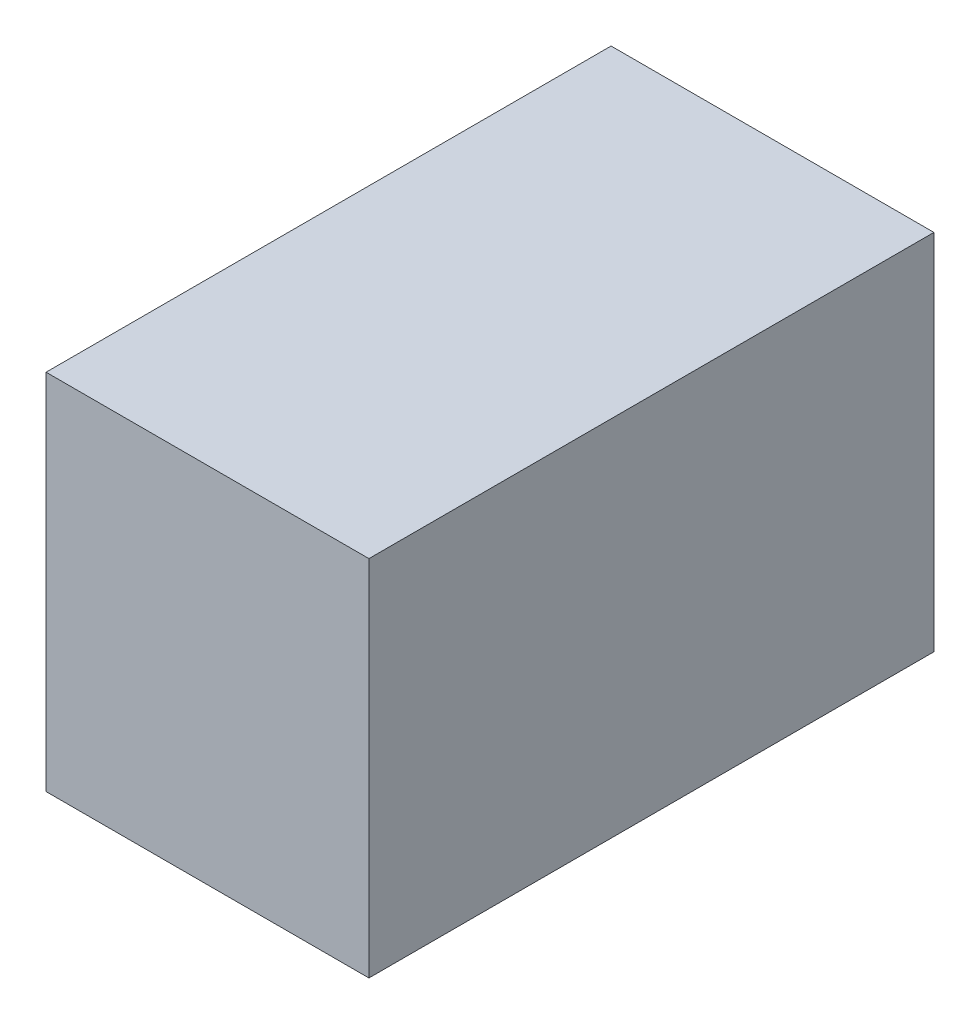
from build123d import *

# Parameters (mm, degrees)
SKETCH1_W           = 40
SKETCH1_H           = 70
BOSS_EXTRUDE1_DEPTH = 45
SKETCH2_W           = 0.474893162
SKETCH2_H           = 5.427350427
SKETCH2_W_2         = 0.474893163
BOSS_EXTRUDE2_DEPTH = 1.6


with BuildPart() as part:
    # Sketch1 → Boss-Extrude1 (new body)
    with BuildSketch(Plane(origin=(0, 0, 0), x_dir=(1, 0, 0), z_dir=(0, 1, 0))):
        Rectangle(SKETCH1_W, SKETCH1_H)
    extrude(amount=BOSS_EXTRUDE1_DEPTH)

    # Sketch2 → Boss-Extrude2 (add)
    # profile 1 of 16: a face of its own
    with BuildSketch(Plane.ZY.offset(20)):
        with BuildLine():
            Line((-18.131363664, 26.278418085), (-17.684031266, 26.546605519))
            add(Edge.make_bspline(
                [(-17.684031266, 26.546605519), (-17.642426312, 26.476960556), (-17.562712826, 26.343523494), (-17.429738747, 26.163216695), (-17.291954465, 26.009966768), (-17.148339639, 25.88466523), (-16.999770884, 25.786015127), (-16.845278327, 25.716161753), (-16.685382589, 25.672594743), (-16.576565026, 25.667302945), (-16.522239065, 25.664661074)],
                knots=[0, 0, 0, 0, 1.272034388, 2.437168799, 3.508375237, 4.49857839, 5.41946034, 6.295179144, 7.148887113, 8, 8, 8, 8], degree=3))
            add(Edge.make_bspline(
                [(-16.522239065, 25.664661074), (-16.475843455, 25.665953258), (-16.383864048, 25.668515014), (-16.248454466, 25.693130036), (-16.116946265, 25.730945993), (-15.992049872, 25.78510383), (-15.875488645, 25.850627493), (-15.773273761, 25.929769928), (-15.684908804, 26.01837693), (-15.612625976, 26.117229277), (-15.557169256, 26.223542108), (-15.514545534, 26.332665273), (-15.490891672, 26.446312989), (-15.487328485, 26.522831189), (-15.485530331, 26.56144593)],
                knots=[0, 0, 0, 0, 1.095163259, 2.171163733, 3.241058638, 4.321873601, 5.38011039, 6.391990106, 7.366004449, 8.327778327, 9.272591725, 10.192022065, 11.087607919, 12, 12, 12, 12], degree=3))
            add(Edge.make_bspline(
                [(-15.485530331, 26.56144593), (-15.487759348, 26.605504119), (-15.492290615, 26.69506798), (-15.5305894, 26.827207932), (-15.590837666, 26.95797646), (-15.646419283, 27.038865279), (-15.67527559, 27.080860326)],
                knots=[0, 0, 0, 0, 0.938893495, 1.908633276, 2.914225137, 4, 4, 4, 4], degree=3))
            add(Edge.make_bspline(
                [(-15.67527559, 27.080860326), (-15.698968066, 27.111169214), (-15.748707457, 27.174798934), (-15.834217029, 27.269512563), (-15.934556273, 27.367209459), (-16.04629141, 27.471620176), (-16.173492628, 27.57788863), (-16.312175893, 27.691082336), (-16.465881966, 27.806896625), (-16.573680014, 27.884567052), (-16.629302032, 27.924643713)],
                knots=[0, 0, 0, 0, 0.722233717, 1.516239348, 2.393582979, 3.351407094, 4.387010283, 5.505090956, 6.712668013, 8, 8, 8, 8], degree=3))
            add(Edge.make_bspline(
                [(-16.629302032, 27.924643713), (-16.684976408, 27.96429884), (-16.791421573, 28.040116422), (-16.940281573, 28.152638851), (-17.073396416, 28.255514702), (-17.190174453, 28.349712434), (-17.290564319, 28.435244825), (-17.375357096, 28.511290518), (-17.442392771, 28.57990614), (-17.479669661, 28.624418645), (-17.496406066, 28.644403662)],
                knots=[0, 0, 0, 0, 1.452282411, 2.77665338, 3.964542531, 5.026858415, 5.96415736, 6.766646006, 7.446254459, 8, 8, 8, 8], degree=3))
            add(Edge.make_bspline(
                [(-17.496406066, 28.644403662), (-17.51979908, 28.675550468), (-17.565804584, 28.736804842), (-17.626531758, 28.832545996), (-17.678146921, 28.930552599), (-17.718609019, 29.031088014), (-17.752681635, 29.132740823), (-17.775598983, 29.236837349), (-17.789949071, 29.342910498), (-17.791418622, 29.414292815), (-17.792154263, 29.450025991)],
                knots=[0, 0, 0, 0, 1.068054152, 2.10047183, 3.106115577, 4.101338837, 5.06977816, 6.043150881, 7.020423561, 8, 8, 8, 8], degree=3))
            add(Edge.make_bspline(
                [(-17.792154263, 29.450025991), (-17.790180911, 29.506011484), (-17.786276387, 29.616785818), (-17.753255605, 29.778606241), (-17.701135872, 29.933102371), (-17.628118602, 30.078744662), (-17.533991413, 30.211740847), (-17.425064761, 30.333620762), (-17.295325967, 30.436080404), (-17.152976167, 30.525603397), (-16.997164748, 30.595674022), (-16.833892787, 30.648531694), (-16.662900785, 30.678481406), (-16.547084141, 30.682779395), (-16.488318125, 30.684960219)],
                knots=[0, 0, 0, 0, 1.005424448, 1.989358655, 2.955360095, 3.929531133, 4.905563448, 5.876582895, 6.856512386, 7.866279853, 8.892233794, 9.918561126, 10.94386622, 12, 12, 12, 12], degree=3))
            add(Edge.make_bspline(
                [(-16.488318125, 30.684960219), (-16.425960973, 30.682809457), (-16.301952501, 30.678532277), (-16.119542377, 30.641343152), (-15.943918437, 30.579807613), (-15.80264112, 30.509974761), (-15.69207135, 30.440228453), (-15.60774829, 30.376698481), (-15.522299287, 30.303559924), (-15.435035085, 30.220617969), (-15.347434326, 30.127111571), (-15.258196487, 30.023681125), (-15.16711289, 29.910958713), (-15.108517721, 29.830488337), (-15.078479049, 29.789235393)],
                knots=[0, 0, 0, 0, 1.286793592, 2.559021753, 3.825965368, 5.121522368, 5.803751409, 6.523245864, 7.299691795, 8.125521123, 9.008227632, 9.944561021, 10.946284179, 12, 12, 12, 12], degree=3))
            Line((-15.078479049, 29.789235393), (-15.507790948, 29.463806373))
            add(Edge.make_bspline(
                [(-15.507790948, 29.463806373), (-15.533713965, 29.49720237), (-15.583635635, 29.56151525), (-15.659426645, 29.651581406), (-15.7308621, 29.73385394), (-15.801241871, 29.805314312), (-15.866848909, 29.869875871), (-15.930525866, 29.925150742), (-15.991356373, 29.971680511), (-16.068035512, 30.021336846), (-16.164370634, 30.070559178), (-16.285299635, 30.112210761), (-16.411674122, 30.137240438), (-16.497746303, 30.140549827), (-16.541319594, 30.142225177)],
                knots=[0, 0, 0, 0, 1.181633172, 2.275549214, 3.290209073, 4.226197932, 5.078386478, 5.862611352, 6.581680152, 7.217281963, 8.414376989, 9.595101626, 10.782541182, 12, 12, 12, 12], degree=3))
            add(Edge.make_bspline(
                [(-16.541319594, 30.142225177), (-16.595984812, 30.140393202), (-16.701401536, 30.136860411), (-16.851065346, 30.098276623), (-16.985766875, 30.037525478), (-17.101507063, 29.952382594), (-17.197871302, 29.851506807), (-17.267578365, 29.735424491), (-17.309533971, 29.607241573), (-17.314653703, 29.517825021), (-17.3172611, 29.472286608)],
                knots=[0, 0, 0, 0, 1.14458467, 2.207223713, 3.21896685, 4.227309161, 5.202851033, 6.127160689, 7.046193047, 8, 8, 8, 8], degree=3))
            add(Edge.make_bspline(
                [(-17.3172611, 29.472286608), (-17.31666673, 29.443936159), (-17.315477018, 29.387188901), (-17.298884169, 29.303351632), (-17.277567327, 29.219726154), (-17.243787395, 29.13668844), (-17.197152234, 29.052786254), (-17.135912266, 28.966574818), (-17.058784996, 28.877294258), (-16.999704275, 28.819225967), (-16.968511434, 28.788567658)],
                knots=[0, 0, 0, 0, 0.858281714, 1.717966888, 2.583508476, 3.4729293, 4.427298488, 5.488583878, 6.674047936, 8, 8, 8, 8], degree=3))
            add(Edge.make_bspline(
                [(-16.968511434, 28.788567658), (-16.956928169, 28.778230726), (-16.929408982, 28.753672542), (-16.879098951, 28.713467546), (-16.812661625, 28.663872879), (-16.731831869, 28.602508722), (-16.63511931, 28.531326035), (-16.522513314, 28.451234978), (-16.395269092, 28.359635535), (-16.304975243, 28.295594967), (-16.25723172, 28.261733056)],
                knots=[0, 0, 0, 0, 0.420754252, 0.999615792, 1.744751191, 2.668019286, 3.750313428, 4.999500688, 6.413464383, 8, 8, 8, 8], degree=3))
            add(Edge.make_bspline(
                [(-16.25723172, 28.261733056), (-16.199800637, 28.219941953), (-16.088593304, 28.139019274), (-15.93036101, 28.017438424), (-15.78689061, 27.898530488), (-15.657678386, 27.783054821), (-15.541447822, 27.671887347), (-15.439488411, 27.563690634), (-15.350761251, 27.459239827), (-15.25524029, 27.325326528), (-15.157635015, 27.160859889), (-15.073812736, 26.959355885), (-15.020959044, 26.757068591), (-15.014047348, 26.621107779), (-15.010637169, 26.554025724)],
                knots=[0, 0, 0, 0, 1.163667725, 2.253281268, 3.268753668, 4.215851969, 5.092017293, 5.902905408, 6.650798638, 7.335211899, 8.59617414, 9.77448103, 10.901945474, 12, 12, 12, 12], degree=3))
            add(Edge.make_bspline(
                [(-15.010637169, 26.554025724), (-15.011630699, 26.506584625), (-15.013598466, 26.4126237), (-15.036217943, 26.274654714), (-15.069358389, 26.14065328), (-15.11930754, 26.012275765), (-15.180272315, 25.887173564), (-15.257630809, 25.768628286), (-15.34729838, 25.654016231), (-15.450158953, 25.546393572), (-15.562714067, 25.447596347), (-15.68167632, 25.359710742), (-15.807240423, 25.286431253), (-15.938725211, 25.226634147), (-16.076160887, 25.179865614), (-16.219501227, 25.145979491), (-16.368982512, 25.125182166), (-16.47058324, 25.123023527), (-16.522239065, 25.121926031)],
                knots=[0, 0, 0, 0, 0.983748083, 1.948392443, 2.894712957, 3.844097841, 4.80183111, 5.778335162, 6.776009319, 7.81870978, 8.863265674, 9.881300176, 10.883814829, 11.87499822, 12.874611388, 13.892143829, 14.928324115, 16, 16, 16, 16], degree=3))
            add(Edge.make_bspline(
                [(-16.522239065, 25.121926031), (-16.562206786, 25.122698889), (-16.641638876, 25.124234872), (-16.759128211, 25.137813712), (-16.874244019, 25.157025643), (-16.985541802, 25.187526915), (-17.094455508, 25.224533773), (-17.200511446, 25.270100062), (-17.303761015, 25.324705831), (-17.404782837, 25.387139975), (-17.503319982, 25.459798708), (-17.598448225, 25.544425304), (-17.69328878, 25.63868577), (-17.785042343, 25.745139836), (-17.875564835, 25.862067652), (-17.963071478, 25.990563203), (-18.049373599, 26.129926583), (-18.103523175, 26.227996415), (-18.131363664, 26.278418085)],
                knots=[0, 0, 0, 0, 0.915332311, 1.819136955, 2.706846663, 3.586547465, 4.459518054, 5.340707479, 6.227863349, 7.133153174, 8.059268498, 9.028702269, 10.047606654, 11.120612155, 12.245963614, 13.433783089, 14.680604001, 16, 16, 16, 16], degree=3))
        make_face()
    # profile 2 of 16: a face of its own
    with BuildSketch(Plane.ZY.offset(20)):
        with BuildLine():
            Line((-14.060850844, 29.124596972), (-13.585957682, 29.124596972))
            Line((-13.585957682, 29.124596972), (-13.585957682, 28.452538344))
            add(Edge.make_bspline(
                [(-13.585957682, 28.452538344), (-13.543195043, 28.511332695), (-13.461257728, 28.623988306), (-13.326901325, 28.772442665), (-13.192680297, 28.898426899), (-13.096019113, 28.964561954), (-13.049582815, 28.996333417)],
                knots=[0, 0, 0, 0, 1.134379233, 2.173579362, 3.122582517, 4, 4, 4, 4], degree=3))
            add(Edge.make_bspline(
                [(-13.049582815, 28.996333417), (-12.986287433, 29.026579624), (-12.860802513, 29.086543601), (-12.662109161, 29.14737291), (-12.458796268, 29.184754909), (-12.321502897, 29.189867223), (-12.252440721, 29.192438852)],
                knots=[0, 0, 0, 0, 1.014936303, 2.012140481, 3.000054389, 4, 4, 4, 4], degree=3))
            add(Edge.make_bspline(
                [(-12.252440721, 29.192438852), (-12.205733452, 29.190858472), (-12.113302279, 29.187730985), (-11.976347762, 29.167380693), (-11.843513909, 29.132204456), (-11.715585555, 29.083207668), (-11.59505548, 29.023870415), (-11.484551574, 28.954247643), (-11.385334021, 28.876086588), (-11.297452967, 28.785857725), (-11.218427179, 28.681027392), (-11.145736542, 28.558768349), (-11.078569852, 28.416335337), (-11.041344778, 28.312971638), (-11.02174661, 28.258552968)],
                knots=[0, 0, 0, 0, 1.009824226, 1.998387844, 2.986035974, 3.974953746, 4.955485308, 5.885931332, 6.793869504, 7.679848016, 8.601185859, 9.625726857, 10.749998409, 12, 12, 12, 12], degree=3))
            add(Edge.make_bspline(
                [(-11.02174661, 28.258552968), (-11.001016504, 28.295933935), (-10.960222566, 28.369494429), (-10.891724758, 28.473601564), (-10.81995797, 28.570978499), (-10.744310582, 28.661702498), (-10.6650496, 28.745325542), (-10.581802006, 28.822124108), (-10.495041682, 28.892428003), (-10.374403415, 28.974559446), (-10.217448639, 29.061798137), (-10.019558275, 29.13743638), (-9.813712182, 29.184178621), (-9.673985424, 29.189667248), (-9.6034273, 29.192438852)],
                knots=[0, 0, 0, 0, 0.86119277, 1.694706429, 2.50939023, 3.298075842, 4.073795165, 4.829715201, 5.57930267, 6.321991688, 7.768977793, 9.186738141, 10.579381044, 12, 12, 12, 12], degree=3))
            add(Edge.make_bspline(
                [(-9.6034273, 29.192438852), (-9.538594612, 29.189993768), (-9.411710747, 29.185208501), (-9.226990357, 29.147632417), (-9.054721199, 29.083107879), (-8.895249905, 28.995064166), (-8.75137733, 28.884424211), (-8.626318148, 28.75278442), (-8.520832004, 28.601075931), (-8.451921441, 28.458364234), (-8.405180506, 28.332369147), (-8.376361735, 28.225014397), (-8.35090172, 28.106856692), (-8.329763409, 27.977754749), (-8.314313931, 27.83725252), (-8.30286773, 27.685579934), (-8.295120619, 27.52261911), (-8.294573201, 27.410185556), (-8.294291015, 27.352227848)],
                knots=[0, 0, 0, 0, 1.209669288, 2.367440248, 3.500751976, 4.631527125, 5.755587489, 6.87532382, 8.007944318, 9.190864318, 9.82315674, 10.514484317, 11.263564316, 12.079023757, 12.955305781, 13.901327259, 14.918167583, 16, 16, 16, 16], degree=3))
            Line((-8.294291015, 27.352227848), (-8.294291015, 25.257609792))
            Line((-8.294291015, 25.257609792), (-8.769184177, 25.257609792))
            Line((-8.769184177, 25.257609792), (-8.769184177, 27.354347906))
            add(Edge.make_bspline(
                [(-8.769184177, 27.354347906), (-8.769301929, 27.403818298), (-8.76952823, 27.498892867), (-8.773600744, 27.635345978), (-8.781274135, 27.759727899), (-8.790246744, 27.871869032), (-8.802710599, 27.972030891), (-8.818806234, 28.060012286), (-8.835857012, 28.13650531), (-8.864184046, 28.221302072), (-8.909462406, 28.314843938), (-8.978431691, 28.41572363), (-9.065321018, 28.503536269), (-9.165651255, 28.579763962), (-9.279873308, 28.641742443), (-9.40576164, 28.686004981), (-9.54253467, 28.713405048), (-9.637214362, 28.716135571), (-9.686109591, 28.71754569)],
                knots=[0, 0, 0, 0, 1.253487763, 2.409012846, 3.458416907, 4.410876679, 5.259312806, 6.014470957, 6.676830364, 7.243083969, 8.276244668, 9.299465089, 10.325150304, 11.392391894, 12.482080715, 13.603491619, 14.762376348, 16, 16, 16, 16], degree=3))
            add(Edge.make_bspline(
                [(-9.686109591, 28.71754569), (-9.746086784, 28.715404594), (-9.864624519, 28.711172977), (-10.037655194, 28.667972002), (-10.203920898, 28.602838766), (-10.358460444, 28.508446837), (-10.500621509, 28.395343715), (-10.622933966, 28.260860398), (-10.723977865, 28.108717532), (-10.792397567, 27.967888589), (-10.835621868, 27.841388359), (-10.864161967, 27.730872094), (-10.886361856, 27.605260676), (-10.907181585, 27.46539816), (-10.920770174, 27.310321816), (-10.933119975, 27.140748995), (-10.938896755, 26.956169676), (-10.939704806, 26.828222182), (-10.940124348, 26.761791483)],
                knots=[0, 0, 0, 0, 1.090531906, 2.155305635, 3.229839962, 4.33261226, 5.44038871, 6.529323825, 7.629011124, 8.757537029, 9.370236727, 10.061839251, 10.834451254, 11.692844982, 12.636905849, 13.66920014, 14.789842145, 16, 16, 16, 16], degree=3))
            Line((-10.940124348, 26.761791483), (-10.940124348, 25.257609792))
            Line((-10.940124348, 25.257609792), (-11.415017511, 25.257609792))
            Line((-11.415017511, 25.257609792), (-11.415017511, 27.223964293))
            add(Edge.make_bspline(
                [(-11.415017511, 27.223964293), (-11.415137603, 27.279441096), (-11.415368648, 27.38617289), (-11.419414985, 27.539228565), (-11.427105472, 27.678446389), (-11.435996301, 27.803664554), (-11.448787285, 27.914655492), (-11.463316331, 28.012014233), (-11.480474349, 28.095496702), (-11.508882865, 28.187062772), (-11.552296406, 28.287938453), (-11.622128659, 28.395496902), (-11.709225835, 28.489640335), (-11.811386564, 28.5700113), (-11.926299916, 28.636446635), (-12.05327482, 28.684313164), (-12.191167962, 28.712168936), (-12.286233065, 28.715719639), (-12.335123013, 28.71754569)],
                knots=[0, 0, 0, 0, 1.320475261, 2.540461679, 3.643808994, 4.639130445, 5.527981419, 6.302341397, 6.981980563, 7.553956391, 8.582137848, 9.585246428, 10.591171744, 11.620968678, 12.668337649, 13.738356861, 14.836885341, 16, 16, 16, 16], degree=3))
            add(Edge.make_bspline(
                [(-12.335123013, 28.71754569), (-12.392599904, 28.71523178), (-12.507149307, 28.71062024), (-12.675427285, 28.669111992), (-12.837935402, 28.604093927), (-12.992081196, 28.513893962), (-13.133707587, 28.402165594), (-13.257696277, 28.270758549), (-13.36193081, 28.121308224), (-13.431072958, 27.981964253), (-13.475671842, 27.85863323), (-13.505298122, 27.753781202), (-13.530758032, 27.63736416), (-13.549678041, 27.509022933), (-13.567942479, 27.369593421), (-13.576757351, 27.218381038), (-13.585332213, 27.055515501), (-13.585744078, 26.943071295), (-13.585957682, 26.884754891)],
                knots=[0, 0, 0, 0, 1.098833095, 2.189935336, 3.297829714, 4.440610912, 5.596351641, 6.740013378, 7.886572111, 9.072425424, 9.705826452, 10.395263256, 11.156850408, 11.985370555, 12.878090359, 13.847760091, 14.883794034, 16, 16, 16, 16], degree=3))
            Line((-13.585957682, 26.884754891), (-13.585957682, 25.257609792))
            Line((-13.585957682, 25.257609792), (-14.060850844, 25.257609792))
            Line((-14.060850844, 25.257609792), (-14.060850844, 29.124596972))
        make_face()
    # profile 3 of 16: a face of its own
    with BuildSketch(Plane.ZY.offset(20)):
        with BuildLine():
            Line((-3.27399187, 29.124596972), (-3.27399187, 25.257609792))
            Line((-3.27399187, 25.257609792), (-3.748885032, 25.257609792))
            Line((-3.748885032, 25.257609792), (-3.748885032, 25.926488331))
            add(Edge.make_bspline(
                [(-3.748885032, 25.926488331), (-3.80243487, 25.865952278), (-3.906938053, 25.74781541), (-4.081474029, 25.593476887), (-4.26648306, 25.465904901), (-4.4610672, 25.362868719), (-4.665050734, 25.285471206), (-4.877981485, 25.230458798), (-5.099946311, 25.195089547), (-5.251518324, 25.191557705), (-5.328328809, 25.189767912)],
                knots=[0, 0, 0, 0, 1.074387032, 2.096679803, 3.090159297, 4.057316773, 5.018401886, 5.985159533, 6.978961417, 8, 8, 8, 8], degree=3))
            add(Edge.make_bspline(
                [(-5.328328809, 25.189767912), (-5.396618453, 25.19162207), (-5.531288656, 25.195278552), (-5.729392141, 25.223645368), (-5.920031614, 25.269199998), (-6.103387218, 25.332550153), (-6.278272485, 25.416583061), (-6.446184774, 25.517187091), (-6.606254201, 25.63699168), (-6.756040933, 25.773952151), (-6.893975029, 25.922716001), (-7.015020048, 26.081383673), (-7.115944347, 26.249269061), (-7.200338993, 26.424246567), (-7.265345371, 26.607663172), (-7.310662652, 26.798884604), (-7.338996422, 26.99768477), (-7.342651392, 27.133060002), (-7.34450469, 27.201703676)],
                knots=[0, 0, 0, 0, 1.033919861, 2.038935746, 3.024066025, 3.998881131, 4.97069526, 5.957263378, 6.95902576, 7.993208707, 9.027059324, 10.027763471, 11.009749337, 11.988697705, 12.965288445, 13.950418724, 14.960734635, 16, 16, 16, 16], degree=3))
            add(Edge.make_bspline(
                [(-7.34450469, 27.201703676), (-7.342610317, 27.268928561), (-7.338865243, 27.401828532), (-7.310965732, 27.597285611), (-7.264049802, 27.785545363), (-7.198209604, 27.966001694), (-7.113781886, 28.13887296), (-7.011081088, 28.304281426), (-6.890099792, 28.462682777), (-6.750622939, 28.61035237), (-6.599531084, 28.746757346), (-6.437895264, 28.865304356), (-6.269736256, 28.967685782), (-6.092445752, 29.048804728), (-5.908647867, 29.11443516), (-5.716706348, 29.159842147), (-5.517419794, 29.186598812), (-5.382118693, 29.190473467), (-5.313488397, 29.192438852)],
                knots=[0, 0, 0, 0, 1.020392517, 2.01726096, 2.990465484, 3.961182959, 4.928053699, 5.906110375, 6.912531644, 7.948652711, 8.985773172, 9.998621852, 10.987621588, 11.969261332, 12.953316658, 13.946091881, 14.958173133, 16, 16, 16, 16], degree=3))
            add(Edge.make_bspline(
                [(-5.313488397, 29.192438852), (-5.234567182, 29.190265109), (-5.079806403, 29.1860025), (-4.853431913, 29.150529091), (-4.639278952, 29.090599504), (-4.435694396, 29.009081382), (-4.243409311, 28.900755327), (-4.064244085, 28.764109434), (-3.896323652, 28.600005496), (-3.798986782, 28.473957324), (-3.748885032, 28.40907714)],
                knots=[0, 0, 0, 0, 1.038897134, 2.037228247, 3.008116434, 3.962042015, 4.918381754, 5.904844433, 6.921570401, 8, 8, 8, 8], degree=3))
            Line((-3.748885032, 28.40907714), (-3.748885032, 29.124596972))
            Line((-3.748885032, 29.124596972), (-3.27399187, 29.124596972))
        make_face()
        with BuildLine():
            add(Edge.make_bspline(
                [(-5.307128221, 28.71754569), (-5.376546327, 28.715075785), (-5.513566627, 28.710200586), (-5.714716487, 28.672140659), (-5.907202244, 28.608815141), (-6.09006119, 28.522210362), (-6.260404803, 28.413309772), (-6.412644044, 28.281590538), (-6.54802408, 28.130646481), (-6.661883003, 27.961158766), (-6.754699588, 27.779460938), (-6.819964029, 27.589528752), (-6.86300682, 27.394787893), (-6.867404226, 27.262703832), (-6.869611528, 27.196403529)],
                knots=[0, 0, 0, 0, 1.031046209, 2.035121221, 3.029706178, 4.034933723, 5.034054252, 6.02443088, 7.017295772, 8.038157696, 9.050218397, 10.03989886, 11.016116709, 12, 12, 12, 12], degree=3))
            add(Edge.make_bspline(
                [(-6.869611528, 27.196403529), (-6.866791987, 27.130499438), (-6.861163956, 26.998949579), (-6.820719454, 26.80394323), (-6.752865359, 26.613966286), (-6.660273193, 26.430631212), (-6.54433032, 26.260414775), (-6.409939143, 26.106593399), (-6.255800027, 25.974317474), (-6.085064392, 25.863589238), (-5.902716627, 25.774141141), (-5.710955802, 25.711902614), (-5.513386682, 25.671719541), (-5.379050416, 25.667025868), (-5.311368339, 25.664661074)],
                knots=[0, 0, 0, 0, 0.979072187, 1.954306742, 2.945804271, 3.96968567, 4.997920485, 5.998718438, 6.996577872, 8.005894225, 9.015743152, 10.005417472, 10.995077863, 12, 12, 12, 12], degree=3))
            add(Edge.make_bspline(
                [(-5.311368339, 25.664661074), (-5.242657555, 25.667170782), (-5.10599862, 25.672162341), (-4.904252002, 25.710385206), (-4.708467951, 25.773535651), (-4.521313451, 25.861073617), (-4.346966444, 25.969563905), (-4.19048751, 26.096574626), (-4.0581717, 26.244292535), (-3.945999541, 26.406635506), (-3.858043851, 26.584604834), (-3.793975285, 26.774098193), (-3.756096166, 26.975122182), (-3.751321979, 27.112499785), (-3.748885032, 27.182623147)],
                knots=[0, 0, 0, 0, 1.01762866, 2.023962475, 3.030623092, 4.058876274, 5.077231937, 6.066672613, 7.034107872, 8.005628644, 8.981990164, 9.965428785, 10.961468474, 12, 12, 12, 12], degree=3))
            add(Edge.make_bspline(
                [(-3.748885032, 27.182623147), (-3.750335941, 27.236050581), (-3.753191789, 27.341212679), (-3.775009436, 27.495619759), (-3.809715098, 27.643383845), (-3.858619427, 27.784660292), (-3.922862202, 27.918667993), (-4.000343943, 28.046369155), (-4.092427183, 28.167099605), (-4.197629593, 28.279196867), (-4.312784125, 28.381441638), (-4.434635395, 28.472706621), (-4.564627072, 28.547680122), (-4.700573068, 28.609730616), (-4.842709252, 28.65910814), (-4.992192213, 28.692049058), (-5.147433062, 28.714667639), (-5.253336027, 28.716576238), (-5.307128221, 28.71754569)],
                knots=[0, 0, 0, 0, 1.050140795, 2.067009409, 3.05949893, 4.030605086, 5.00011959, 5.97591094, 6.962425594, 7.979863591, 8.993523472, 9.986985069, 10.967611495, 11.937549037, 12.921786183, 13.919465291, 14.943216303, 16, 16, 16, 16], degree=3))
        make_face(mode=Mode.SUBTRACT)
    # profile 4 of 16: a face of its own
    with BuildSketch(Plane.ZY.offset(20)):
        with Locations((-2.018917083, 27.971285006)):
            Rectangle(SKETCH2_W, SKETCH2_H)
    # profile 5 of 16: a face of its own
    with BuildSketch(Plane.ZY.offset(20)):
        with Locations((-0.526395716, 27.971285006)):
            Rectangle(SKETCH2_W_2, SKETCH2_H)
    # profile 6 of 16: a face of its own
    with BuildSketch(Plane.ZY.offset(20)):
        Polygon((-18.199205545, 20.187096972), (-18.199205545, 20.729832014), (-15.417688451, 20.729832014), (-15.417688451, 20.187096972), (-16.571000417, 20.187096972), (-16.571000417, 15.438165348), (-17.045893579, 15.438165348), (-17.045893579, 20.187096972), align=None)
    # profile 7 of 16: a face of its own
    with BuildSketch(Plane.ZY.offset(20)):
        with BuildLine():
            Line((-14.874953408, 19.305152527), (-14.400060246, 19.305152527))
            Line((-14.400060246, 19.305152527), (-14.400060246, 18.73591675))
            add(Edge.make_bspline(
                [(-14.400060246, 18.73591675), (-14.365001051, 18.788917824), (-14.297950613, 18.890281966), (-14.186503684, 19.024341504), (-14.072349838, 19.135338062), (-13.954942591, 19.223789811), (-13.833418559, 19.290031074), (-13.710444834, 19.338552687), (-13.584086683, 19.36724458), (-13.499175203, 19.371075231), (-13.456634097, 19.372994408)],
                knots=[0, 0, 0, 0, 1.2804753, 2.448899062, 3.506932113, 4.484331642, 5.4025378, 6.288909075, 7.142734305, 8, 8, 8, 8], degree=3))
            add(Edge.make_bspline(
                [(-13.456634097, 19.372994408), (-13.42363477, 19.371194445), (-13.35573651, 19.367490904), (-13.252953309, 19.341469776), (-13.147054281, 19.299925623), (-13.07880329, 19.260857668), (-13.043222639, 19.240490735)],
                knots=[0, 0, 0, 0, 0.901110191, 1.854092781, 2.881294221, 4, 4, 4, 4], degree=3))
            Line((-13.043222639, 19.240490735), (-13.303989866, 18.829199335))
            add(Edge.make_bspline(
                [(-13.303989866, 18.829199335), (-13.326833267, 18.839389976), (-13.370194415, 18.858733762), (-13.433625724, 18.881627039), (-13.492108221, 18.895107055), (-13.529366934, 18.897149211), (-13.546736594, 18.898101245)],
                knots=[0, 0, 0, 0, 1.180555205, 2.24091978, 3.179933427, 4, 4, 4, 4], degree=3))
            add(Edge.make_bspline(
                [(-13.546736594, 18.898101245), (-13.584845263, 18.895561189), (-13.6625759, 18.89038021), (-13.776701274, 18.849651298), (-13.887444073, 18.78384528), (-13.975394086, 18.710863956), (-14.043493683, 18.64048812), (-14.092086643, 18.579031606), (-14.136661749, 18.510121056), (-14.179252439, 18.43493451), (-14.218057431, 18.352188196), (-14.25427461, 18.262708813), (-14.287020748, 18.166392726), (-14.305693141, 18.099290582), (-14.315257895, 18.064918152)],
                knots=[0, 0, 0, 0, 1.125678352, 2.296057538, 3.5422874, 4.923748041, 5.663163013, 6.437101912, 7.23742474, 8.08941207, 8.991984279, 9.93940061, 10.944477711, 12, 12, 12, 12], degree=3))
            add(Edge.make_bspline(
                [(-14.315257895, 18.064918152), (-14.322412823, 18.034260997), (-14.338260445, 17.966357728), (-14.35366908, 17.852437934), (-14.368893232, 17.717842641), (-14.379622643, 17.562197197), (-14.389568016, 17.385890287), (-14.395177307, 17.188653322), (-14.39986896, 16.970283851), (-14.399994549, 16.817620245), (-14.400060246, 16.737761368)],
                knots=[0, 0, 0, 0, 0.566838948, 1.255505196, 2.06880316, 3.007127437, 4.065329342, 5.249902469, 6.561414163, 8, 8, 8, 8], degree=3))
            Line((-14.400060246, 16.737761368), (-14.400060246, 15.438165348))
            Line((-14.400060246, 15.438165348), (-14.874953408, 15.438165348))
            Line((-14.874953408, 15.438165348), (-14.874953408, 19.305152527))
        make_face()
    # profile 8 of 16: a face of its own
    with BuildSketch(Plane.ZY.offset(20)):
        with BuildLine():
            Line((-8.633500417, 19.305152527), (-8.633500417, 15.438165348))
            Line((-8.633500417, 15.438165348), (-9.108393579, 15.438165348))
            Line((-9.108393579, 15.438165348), (-9.108393579, 16.107043887))
            add(Edge.make_bspline(
                [(-9.108393579, 16.107043887), (-9.161943417, 16.046507834), (-9.2664466, 15.928370966), (-9.440982576, 15.774032443), (-9.625991607, 15.646460457), (-9.820575747, 15.543424275), (-10.024559281, 15.466026761), (-10.237490032, 15.411014354), (-10.459454858, 15.375645103), (-10.611026871, 15.37211326), (-10.687837356, 15.370323467)],
                knots=[0, 0, 0, 0, 1.074387032, 2.096679803, 3.090159297, 4.057316773, 5.018401886, 5.985159533, 6.978961417, 8, 8, 8, 8], degree=3))
            add(Edge.make_bspline(
                [(-10.687837356, 15.370323467), (-10.756127, 15.372177625), (-10.890797203, 15.375834107), (-11.088900688, 15.404200923), (-11.279540161, 15.449755554), (-11.462895765, 15.513105708), (-11.637781032, 15.597138617), (-11.805693321, 15.697742647), (-11.965762748, 15.817547235), (-12.11554948, 15.954507707), (-12.253483576, 16.103271556), (-12.374528595, 16.261939228), (-12.475452894, 16.429824616), (-12.55984754, 16.604802123), (-12.624853918, 16.788218727), (-12.670171199, 16.97944016), (-12.698504969, 17.178240326), (-12.702159939, 17.313615557), (-12.704013237, 17.382259231)],
                knots=[0, 0, 0, 0, 1.033919861, 2.038935746, 3.024066025, 3.998881131, 4.97069526, 5.957263378, 6.95902576, 7.993208707, 9.027059324, 10.027763471, 11.009749337, 11.988697705, 12.965288445, 13.950418724, 14.960734635, 16, 16, 16, 16], degree=3))
            add(Edge.make_bspline(
                [(-12.704013237, 17.382259231), (-12.702118864, 17.449484116), (-12.69837379, 17.582384088), (-12.670474279, 17.777841167), (-12.623558349, 17.966100918), (-12.557718151, 18.146557249), (-12.473290433, 18.319428515), (-12.370589635, 18.484836982), (-12.249608339, 18.643238333), (-12.110131486, 18.790907926), (-11.959039631, 18.927312902), (-11.797403811, 19.045859911), (-11.629244803, 19.148241337), (-11.451954299, 19.229360284), (-11.268156414, 19.294990716), (-11.076214895, 19.340397703), (-10.876928341, 19.367154367), (-10.74162724, 19.371029023), (-10.672996944, 19.372994408)],
                knots=[0, 0, 0, 0, 1.020392517, 2.01726096, 2.990465484, 3.961182959, 4.928053699, 5.906110375, 6.912531644, 7.948652711, 8.985773172, 9.998621852, 10.987621588, 11.969261332, 12.953316658, 13.946091881, 14.958173133, 16, 16, 16, 16], degree=3))
            add(Edge.make_bspline(
                [(-10.672996944, 19.372994408), (-10.594075729, 19.370820664), (-10.43931495, 19.366558056), (-10.21294046, 19.331084647), (-9.998787499, 19.27115506), (-9.795202943, 19.189636937), (-9.602917858, 19.081310883), (-9.423752632, 18.944664989), (-9.255832199, 18.780561052), (-9.158495329, 18.65451288), (-9.108393579, 18.589632695)],
                knots=[0, 0, 0, 0, 1.038897134, 2.037228247, 3.008116434, 3.962042015, 4.918381754, 5.904844433, 6.921570401, 8, 8, 8, 8], degree=3))
            Line((-9.108393579, 18.589632695), (-9.108393579, 19.305152527))
            Line((-9.108393579, 19.305152527), (-8.633500417, 19.305152527))
        make_face()
        with BuildLine():
            add(Edge.make_bspline(
                [(-10.666636768, 18.898101245), (-10.736054874, 18.89563134), (-10.873075174, 18.890756142), (-11.074225034, 18.852696214), (-11.266710791, 18.789370697), (-11.449569737, 18.702765917), (-11.61991335, 18.593865328), (-11.772152591, 18.462146093), (-11.907532627, 18.311202036), (-12.02139155, 18.141714322), (-12.114208135, 17.960016494), (-12.179472576, 17.770084307), (-12.222515367, 17.575343448), (-12.226912773, 17.443259388), (-12.229120075, 17.376959084)],
                knots=[0, 0, 0, 0, 1.031046209, 2.035121221, 3.029706178, 4.034933723, 5.034054252, 6.02443088, 7.017295772, 8.038157696, 9.050218397, 10.03989886, 11.016116709, 12, 12, 12, 12], degree=3))
            add(Edge.make_bspline(
                [(-12.229120075, 17.376959084), (-12.226300534, 17.311054994), (-12.220672503, 17.179505134), (-12.180228001, 16.984498786), (-12.112373906, 16.794521842), (-12.01978174, 16.611186768), (-11.903838867, 16.440970331), (-11.76944769, 16.287148955), (-11.615308574, 16.15487303), (-11.444572939, 16.044144793), (-11.262225174, 15.954696696), (-11.070464349, 15.89245817), (-10.872895229, 15.852275097), (-10.738558963, 15.847581423), (-10.670876886, 15.84521663)],
                knots=[0, 0, 0, 0, 0.979072187, 1.954306742, 2.945804271, 3.96968567, 4.997920485, 5.998718438, 6.996577872, 8.005894225, 9.015743152, 10.005417472, 10.995077863, 12, 12, 12, 12], degree=3))
            add(Edge.make_bspline(
                [(-10.670876886, 15.84521663), (-10.602166102, 15.847726337), (-10.465507167, 15.852717896), (-10.263760549, 15.890940762), (-10.067976498, 15.954091207), (-9.880821998, 16.041629172), (-9.706474991, 16.15011946), (-9.549996057, 16.277130181), (-9.417680247, 16.42484809), (-9.305508088, 16.587191061), (-9.217552398, 16.765160389), (-9.153483832, 16.954653749), (-9.115604713, 17.155677737), (-9.110830526, 17.293055341), (-9.108393579, 17.363178702)],
                knots=[0, 0, 0, 0, 1.01762866, 2.023962475, 3.030623092, 4.058876274, 5.077231937, 6.066672613, 7.034107872, 8.005628644, 8.981990164, 9.965428785, 10.961468474, 12, 12, 12, 12], degree=3))
            add(Edge.make_bspline(
                [(-9.108393579, 17.363178702), (-9.109844488, 17.416606137), (-9.112700336, 17.521768235), (-9.134517983, 17.676175315), (-9.169223645, 17.823939401), (-9.218127974, 17.965215847), (-9.282370749, 18.099223549), (-9.35985249, 18.22692471), (-9.45193573, 18.347655161), (-9.55713814, 18.459752423), (-9.672292672, 18.561997193), (-9.794143942, 18.653262176), (-9.924135619, 18.728235678), (-10.060081615, 18.790286172), (-10.202217799, 18.839663696), (-10.35170076, 18.872604614), (-10.506941609, 18.895223194), (-10.612844574, 18.897131794), (-10.666636768, 18.898101245)],
                knots=[0, 0, 0, 0, 1.050140795, 2.067009409, 3.05949893, 4.030605086, 5.00011959, 5.97591094, 6.962425594, 7.979863591, 8.993523472, 9.986985069, 10.967611495, 11.937549037, 12.921786183, 13.919465291, 14.943216303, 16, 16, 16, 16], degree=3))
        make_face(mode=Mode.SUBTRACT)
    # profile 9 of 16: a face of its own
    with BuildSketch(Plane.ZY.offset(20)):
        with BuildLine():
            Line((-7.548030331, 19.305152527), (-7.073137169, 19.305152527))
            Line((-7.073137169, 19.305152527), (-7.073137169, 18.607653195))
            add(Edge.make_bspline(
                [(-7.073137169, 18.607653195), (-7.022431458, 18.670915407), (-6.924035259, 18.793677936), (-6.760168469, 18.955029281), (-6.586989001, 19.087994086), (-6.4055574, 19.193984345), (-6.215627373, 19.273883411), (-6.018356655, 19.331586664), (-5.812564183, 19.366186345), (-5.67261557, 19.370707289), (-5.601816389, 19.372994408)],
                knots=[0, 0, 0, 0, 1.12780773, 2.188550248, 3.19190651, 4.159438251, 5.104880172, 6.052711206, 7.014878035, 8, 8, 8, 8], degree=3))
            add(Edge.make_bspline(
                [(-5.601816389, 19.372994408), (-5.530256978, 19.370355838), (-5.390197949, 19.365191522), (-5.186275166, 19.324344858), (-4.995815392, 19.254577627), (-4.81949773, 19.159006997), (-4.660555396, 19.040161495), (-4.520969013, 18.901704611), (-4.405515056, 18.742446485), (-4.328109519, 18.59469838), (-4.277119552, 18.463633179), (-4.245018279, 18.351379164), (-4.217757153, 18.226317197), (-4.194123438, 18.088825199), (-4.178131853, 17.93793984), (-4.165519102, 17.774279639), (-4.156479886, 17.597897609), (-4.156121252, 17.475907112), (-4.155936314, 17.413000083)],
                knots=[0, 0, 0, 0, 1.235846778, 2.418850247, 3.575807741, 4.728682307, 5.871620074, 6.994088408, 8.11269785, 9.256955736, 9.865816715, 10.540099792, 11.271859618, 12.076849838, 12.949306005, 13.892391288, 14.913166135, 16, 16, 16, 16], degree=3))
            Line((-4.155936314, 17.413000083), (-4.155936314, 15.438165348))
            Line((-4.155936314, 15.438165348), (-4.630829476, 15.438165348))
            Line((-4.630829476, 15.438165348), (-4.630829476, 17.257175764))
            add(Edge.make_bspline(
                [(-4.630829476, 17.257175764), (-4.631121588, 17.309823985), (-4.631680349, 17.41053107), (-4.633442696, 17.55471995), (-4.637690856, 17.68547942), (-4.643660329, 17.802496868), (-4.652397673, 17.905659931), (-4.661503318, 17.995178718), (-4.672638461, 18.070939574), (-4.682560961, 18.116546306), (-4.687011034, 18.13700015)],
                knots=[0, 0, 0, 0, 1.430800155, 2.736877192, 3.918605307, 4.986035426, 5.920637409, 6.731861385, 7.431261377, 8, 8, 8, 8], degree=3))
            add(Edge.make_bspline(
                [(-4.687011034, 18.13700015), (-4.703075825, 18.19703968), (-4.733995579, 18.312597198), (-4.810398149, 18.469342946), (-4.906879112, 18.602690206), (-5.024653242, 18.711814535), (-5.162582916, 18.796739491), (-5.320285382, 18.855664398), (-5.496238803, 18.892518996), (-5.619994833, 18.896188588), (-5.68449868, 18.898101245)],
                knots=[0, 0, 0, 0, 1.084156227, 2.086665306, 3.027808233, 3.945421172, 4.874247719, 5.839848303, 6.874090471, 8, 8, 8, 8], degree=3))
            add(Edge.make_bspline(
                [(-5.68449868, 18.898101245), (-5.722701012, 18.897381571), (-5.798302438, 18.895957356), (-5.910410134, 18.881667893), (-6.019152633, 18.858296181), (-6.125621283, 18.826744788), (-6.227686638, 18.783410167), (-6.328627887, 18.734228857), (-6.424644066, 18.672923822), (-6.517782536, 18.604599907), (-6.604434043, 18.528884915), (-6.685061412, 18.448989048), (-6.756934371, 18.363905695), (-6.822050106, 18.275005774), (-6.878260099, 18.181068352), (-6.927326078, 18.082999699), (-6.968957426, 17.980670736), (-6.989644354, 17.909648917), (-6.999995141, 17.874112864)],
                knots=[0, 0, 0, 0, 1.023777757, 2.026029729, 3.023749952, 4.003683103, 4.997618607, 5.993177895, 7.010360494, 8.046726602, 9.087585522, 10.09234134, 11.086953743, 12.070360549, 13.043493632, 14.017870808, 15.008233677, 16, 16, 16, 16], degree=3))
            add(Edge.make_bspline(
                [(-6.999995141, 17.874112864), (-7.005951515, 17.84802464), (-7.018918228, 17.791231942), (-7.032923274, 17.698031451), (-7.045634727, 17.59021756), (-7.056273939, 17.467916081), (-7.062783318, 17.330698817), (-7.069880799, 17.179151776), (-7.072464737, 17.012670669), (-7.072906748, 16.896765491), (-7.073137169, 16.8363441)],
                knots=[0, 0, 0, 0, 0.615963638, 1.340920617, 2.168419149, 3.115676021, 4.16674242, 5.331190069, 6.6087489, 8, 8, 8, 8], degree=3))
            Line((-7.073137169, 16.8363441), (-7.073137169, 15.438165348))
            Line((-7.073137169, 15.438165348), (-7.548030331, 15.438165348))
            Line((-7.548030331, 15.438165348), (-7.548030331, 19.305152527))
        make_face()
    # profile 10 of 16: a face of its own
    with BuildSketch(Plane.ZY.offset(20)):
        with BuildLine():
            Line((-1.238735459, 18.822839159), (-1.560984391, 18.491049963))
            add(Edge.make_bspline(
                [(-1.560984391, 18.491049963), (-1.588789081, 18.523273411), (-1.64239325, 18.585396424), (-1.727409893, 18.668456036), (-1.812112246, 18.738210694), (-1.89534081, 18.7971028), (-1.979188431, 18.841627105), (-2.062671152, 18.874125289), (-2.145875412, 18.894236352), (-2.201492394, 18.89682842), (-2.228802901, 18.898101245)],
                knots=[0, 0, 0, 0, 1.26578478, 2.440284043, 3.530471711, 4.527705817, 5.468200915, 6.346673037, 7.188140097, 8, 8, 8, 8], degree=3))
            add(Edge.make_bspline(
                [(-2.228802901, 18.898101245), (-2.262275549, 18.89647614), (-2.328144985, 18.893278162), (-2.422526877, 18.861356666), (-2.510142703, 18.81235774), (-2.58597528, 18.74285762), (-2.650212606, 18.66308307), (-2.697102338, 18.573886246), (-2.725777099, 18.477958846), (-2.729412825, 18.411389895), (-2.731256827, 18.377626819)],
                knots=[0, 0, 0, 0, 0.99966794, 1.967205029, 2.953328237, 3.988086729, 5.028030931, 6.008226631, 6.989793394, 8, 8, 8, 8], degree=3))
            add(Edge.make_bspline(
                [(-2.731256827, 18.377626819), (-2.729577384, 18.347068134), (-2.726223234, 18.286036907), (-2.700147898, 18.196005951), (-2.658621812, 18.108229238), (-2.619810923, 18.054461511), (-2.599813184, 18.026757094)],
                knots=[0, 0, 0, 0, 0.960159726, 1.917612774, 2.927026955, 4, 4, 4, 4], degree=3))
            add(Edge.make_bspline(
                [(-2.599813184, 18.026757094), (-2.587773139, 18.011963735), (-2.562147423, 17.980477933), (-2.514055978, 17.93677806), (-2.459593384, 17.888484418), (-2.394097764, 17.840198962), (-2.320390853, 17.789350997), (-2.236874316, 17.73794301), (-2.146198576, 17.68205632), (-2.081281458, 17.646610566), (-2.047537876, 17.628186047)],
                knots=[0, 0, 0, 0, 0.66740084, 1.420478572, 2.27185888, 3.217733974, 4.268547843, 5.408967954, 6.65319498, 8, 8, 8, 8], degree=3))
            add(Edge.make_bspline(
                [(-2.047537876, 17.628186047), (-2.00639354, 17.605137206), (-1.926916229, 17.560614435), (-1.813987879, 17.491505716), (-1.711500328, 17.42281773), (-1.618585212, 17.355285066), (-1.537030334, 17.28701823), (-1.464361308, 17.220633883), (-1.402390685, 17.154126238), (-1.367686534, 17.107660698), (-1.351098574, 17.085451005)],
                knots=[0, 0, 0, 0, 1.27191281, 2.456916733, 3.569705269, 4.599008579, 5.553216877, 6.436649441, 7.252746552, 8, 8, 8, 8], degree=3))
            add(Edge.make_bspline(
                [(-1.351098574, 17.085451005), (-1.32356599, 17.040598705), (-1.26877104, 16.951334304), (-1.211230566, 16.804349301), (-1.177877531, 16.648456041), (-1.173247746, 16.541818041), (-1.170893579, 16.487594434)],
                knots=[0, 0, 0, 0, 0.995354457, 1.980940102, 2.973342416, 4, 4, 4, 4], degree=3))
            add(Edge.make_bspline(
                [(-1.170893579, 16.487594434), (-1.171981446, 16.449389892), (-1.174125206, 16.374103667), (-1.189029664, 16.263228389), (-1.214663973, 16.157191617), (-1.24957953, 16.054842794), (-1.296727332, 15.958142969), (-1.35198412, 15.864652449), (-1.418318808, 15.776393602), (-1.494052198, 15.693482317), (-1.576973361, 15.617757437), (-1.66542907, 15.551197411), (-1.759528255, 15.495900497), (-1.858598538, 15.450142177), (-1.962865015, 15.413753263), (-2.072343988, 15.388561103), (-2.186687462, 15.373483238), (-2.264444434, 15.371390042), (-2.304064987, 15.370323467)],
                knots=[0, 0, 0, 0, 1.032770009, 2.035186124, 3.017557409, 3.978232242, 4.952395191, 5.920591857, 6.910227898, 7.931268572, 8.952309245, 9.941945286, 10.918353717, 11.897095711, 12.887975737, 13.898235213, 14.929059601, 16, 16, 16, 16], degree=3))
            add(Edge.make_bspline(
                [(-2.304064987, 15.370323467), (-2.357536787, 15.371824336), (-2.463737403, 15.374805218), (-2.620808764, 15.40278462), (-2.774298483, 15.446320513), (-2.923045026, 15.506367223), (-3.063721889, 15.582190325), (-3.192431739, 15.672998944), (-3.309621688, 15.775793344), (-3.376324316, 15.854583102), (-3.40967563, 15.893977981)],
                knots=[0, 0, 0, 0, 1.013940152, 2.01379169, 3.017749504, 4.037548394, 5.051665909, 6.043208538, 7.021604269, 8, 8, 8, 8], degree=3))
            Line((-3.40967563, 15.893977981), (-3.094846904, 16.252267912))
            add(Edge.make_bspline(
                [(-3.094846904, 16.252267912), (-3.064952899, 16.219981542), (-3.00699885, 16.157389531), (-2.914317248, 16.074046778), (-2.820005534, 16.004194856), (-2.725005473, 15.945769693), (-2.627910806, 15.90075212), (-2.529265651, 15.869125198), (-2.429270653, 15.84879886), (-2.362108614, 15.846412647), (-2.328445662, 15.84521663)],
                knots=[0, 0, 0, 0, 1.179806542, 2.287233372, 3.337373186, 4.324005949, 5.273901747, 6.200048787, 7.097828587, 8, 8, 8, 8], degree=3))
            add(Edge.make_bspline(
                [(-2.328445662, 15.84521663), (-2.282607846, 15.847289186), (-2.193048441, 15.851338614), (-2.064772758, 15.888103742), (-1.946332216, 15.945752597), (-1.843487396, 16.02752351), (-1.755944843, 16.12270634), (-1.692553436, 16.229921735), (-1.652826362, 16.346023104), (-1.648160626, 16.426505276), (-1.645786741, 16.467453876)],
                knots=[0, 0, 0, 0, 1.072336372, 2.095165389, 3.102688358, 4.141489647, 5.156069229, 6.117746104, 7.042326257, 8, 8, 8, 8], degree=3))
            add(Edge.make_bspline(
                [(-1.645786741, 16.467453876), (-1.647429115, 16.501183895), (-1.650671762, 16.567779301), (-1.676137185, 16.664163746), (-1.716373283, 16.755587539), (-1.755992216, 16.809093315), (-1.776170355, 16.8363441)],
                knots=[0, 0, 0, 0, 1.013901739, 2.00181326, 2.98231254, 4, 4, 4, 4], degree=3))
            add(Edge.make_bspline(
                [(-1.776170355, 16.8363441), (-1.788299451, 16.850004707), (-1.814721004, 16.879762443), (-1.863185476, 16.922738455), (-1.921215196, 16.969060343), (-1.989462823, 17.017942627), (-2.068065938, 17.068740518), (-2.157343121, 17.121187515), (-2.256071338, 17.177774672), (-2.325876935, 17.215299627), (-2.362366602, 17.234915147)],
                knots=[0, 0, 0, 0, 0.615000592, 1.339693406, 2.178160186, 3.116406724, 4.166410947, 5.330106347, 6.604359322, 8, 8, 8, 8], degree=3))
            add(Edge.make_bspline(
                [(-2.362366602, 17.234915147), (-2.401746642, 17.25689693), (-2.478117105, 17.299526621), (-2.586289795, 17.365923552), (-2.683879247, 17.433456217), (-2.773233687, 17.498336343), (-2.85209616, 17.563984675), (-2.920155987, 17.630474091), (-2.980092753, 17.695123118), (-3.01327515, 17.740929745), (-3.029125083, 17.762809779)],
                knots=[0, 0, 0, 0, 1.262093308, 2.447601706, 3.550203992, 4.582594899, 5.537233252, 6.418365656, 7.244515135, 8, 8, 8, 8], degree=3))
            add(Edge.make_bspline(
                [(-3.029125083, 17.762809779), (-3.056536823, 17.806875173), (-3.111369882, 17.89502136), (-3.164611897, 18.042145533), (-3.201209107, 18.197032703), (-3.204478435, 18.303904495), (-3.206149989, 18.358546291)],
                knots=[0, 0, 0, 0, 0.985009483, 1.970363186, 2.962279964, 4, 4, 4, 4], degree=3))
            add(Edge.make_bspline(
                [(-3.206149989, 18.358546291), (-3.205342337, 18.394265642), (-3.203761646, 18.464173474), (-3.191146235, 18.5668905), (-3.168177815, 18.664481161), (-3.139368586, 18.758411061), (-3.099328806, 18.846860656), (-3.051483211, 18.931009451), (-2.995259366, 19.010741137), (-2.930484391, 19.084829206), (-2.85926363, 19.152123068), (-2.782315585, 19.210782898), (-2.70137084, 19.260836554), (-2.616086682, 19.302814832), (-2.525643824, 19.334566923), (-2.430674454, 19.356425112), (-2.331370803, 19.371022859), (-2.263484577, 19.37232776), (-2.228802901, 19.372994408)],
                knots=[0, 0, 0, 0, 1.087655834, 2.128696564, 3.144119009, 4.137814668, 5.115653402, 6.093965665, 7.082169637, 8.081268856, 9.086088321, 10.061021666, 11.022561449, 11.980240094, 12.950172527, 13.934149372, 14.944599409, 16, 16, 16, 16], degree=3))
            add(Edge.make_bspline(
                [(-2.228802901, 19.372994408), (-2.18769109, 19.37132475), (-2.104696255, 19.367954113), (-1.980183904, 19.341184795), (-1.855854922, 19.297138316), (-1.731389857, 19.236304963), (-1.607700491, 19.157584805), (-1.483698815, 19.062441698), (-1.357896198, 18.951501582), (-1.279343201, 18.866684896), (-1.238735459, 18.822839159)],
                knots=[0, 0, 0, 0, 0.845714091, 1.707292901, 2.609013841, 3.555613372, 4.552488639, 5.621697636, 6.770543573, 8, 8, 8, 8], degree=3))
        make_face()
    # profile 11 of 16: a face of its own
    with BuildSketch(Plane.ZY.offset(20)):
        with BuildLine():
            Line((1.407097874, 20.833714894), (1.407097874, 20.339741202))
            add(Edge.make_bspline(
                [(1.407097874, 20.339741202), (1.362135672, 20.357809783), (1.276796479, 20.392104325), (1.150944958, 20.429394889), (1.03524065, 20.453488211), (0.960924649, 20.456868746), (0.925844535, 20.458464493)],
                knots=[0, 0, 0, 0, 1.16548392, 2.212112691, 3.15604595, 4, 4, 4, 4], degree=3))
            add(Edge.make_bspline(
                [(0.925844535, 20.458464493), (0.902147297, 20.457479729), (0.856277347, 20.455573553), (0.79035327, 20.445854613), (0.730951727, 20.426044426), (0.678177753, 20.400297781), (0.634407414, 20.368012289), (0.596933004, 20.335573974), (0.569769322, 20.299008284), (0.555020771, 20.264959569), (0.546024936, 20.233434852), (0.543318433, 20.201149235), (0.53668886, 20.161500915), (0.534840093, 20.112872436), (0.530625857, 20.056776672), (0.530998755, 19.992026483), (0.527545681, 19.919640803), (0.528062623, 19.868386401), (0.528333518, 19.841527394)],
                knots=[0, 0, 0, 0, 1.311993654, 2.539582093, 3.670788641, 4.763509788, 5.772417512, 6.671800701, 7.496729179, 8.266799162, 8.712543678, 9.304149002, 10.05334463, 10.934920737, 11.99209668, 13.165090968, 14.514413552, 16, 16, 16, 16], degree=3))
            Line((0.528333518, 19.841527394), (0.528333518, 19.305152527))
            Line((0.528333518, 19.305152527), (1.339255994, 19.305152527))
            Line((1.339255994, 19.305152527), (1.339255994, 18.830259365))
            Line((1.339255994, 18.830259365), (0.527273488, 18.830259365))
            Line((0.527273488, 18.830259365), (0.52515343, 15.438165348))
            Line((0.52515343, 15.438165348), (0.050260267, 15.438165348))
            Line((0.050260267, 15.438165348), (0.050260267, 18.830259365))
            Line((0.050260267, 18.830259365), (-0.492474776, 18.830259365))
            Line((-0.492474776, 18.830259365), (-0.492474776, 19.305152527))
            Line((-0.492474776, 19.305152527), (0.050260267, 19.305152527))
            Line((0.050260267, 19.305152527), (0.050260267, 19.923149656))
            add(Edge.make_bspline(
                [(0.050260267, 19.923149656), (0.050298389, 19.957432973), (0.050371522, 20.023202198), (0.05549363, 20.117861708), (0.059871683, 20.20528528), (0.068591787, 20.284794284), (0.078663652, 20.357133096), (0.093081417, 20.421227094), (0.106705752, 20.478803087), (0.131423266, 20.5439702), (0.168347336, 20.617826784), (0.228113228, 20.695877203), (0.299766942, 20.765885874), (0.385353336, 20.824861277), (0.481685157, 20.873870392), (0.588850748, 20.90900986), (0.705683487, 20.928876961), (0.786551448, 20.931831539), (0.828321832, 20.933357655)],
                knots=[0, 0, 0, 0, 1.116398763, 2.141702935, 3.087165306, 3.966655413, 4.746276475, 5.464069668, 6.106083417, 6.67047701, 7.730773247, 8.782666744, 9.856985883, 10.980834087, 12.154321827, 13.366232824, 14.639591414, 16, 16, 16, 16], degree=3))
            add(Edge.make_bspline(
                [(0.828321832, 20.933357655), (0.870771217, 20.931910187), (0.959891447, 20.928871304), (1.09928393, 20.910073176), (1.249864379, 20.877611024), (1.353181783, 20.848767079), (1.407097874, 20.833714894)],
                knots=[0, 0, 0, 0, 0.864728408, 1.815451418, 2.859995356, 4, 4, 4, 4], degree=3))
        make_face()
    # profile 12 of 16: a face of its own
    with BuildSketch(Plane.ZY.offset(20)):
        with BuildLine():
            add(Edge.make_bspline(
                [(3.953288446, 19.372994408), (4.02584668, 19.371449405), (4.168115644, 19.368420034), (4.376468043, 19.336042645), (4.57535176, 19.286531749), (4.765528503, 19.218085459), (4.944562664, 19.126340129), (5.115062045, 19.016864177), (5.27655919, 18.887169065), (5.373355912, 18.786841986), (5.422489167, 18.73591675)],
                knots=[0, 0, 0, 0, 1.054011418, 2.066658804, 3.057071809, 4.030435133, 4.997543892, 5.974964718, 6.972108034, 8, 8, 8, 8], degree=3))
            add(Edge.make_bspline(
                [(5.422489167, 18.73591675), (5.464795216, 18.687212271), (5.548588577, 18.59074588), (5.656033176, 18.434330846), (5.748594344, 18.272345218), (5.822772868, 18.10263795), (5.88126094, 17.926690531), (5.922786457, 17.743898204), (5.947486347, 17.554664656), (5.950817023, 17.426146948), (5.952503857, 17.361058644)],
                knots=[0, 0, 0, 0, 1.025258237, 2.030674902, 3.01204498, 3.988269485, 4.97094183, 5.956517959, 6.965070386, 8, 8, 8, 8], degree=3))
            add(Edge.make_bspline(
                [(5.952503857, 17.361058644), (5.951020168, 17.29559308), (5.948088331, 17.166230074), (5.92035453, 16.975700795), (5.877218245, 16.79095386), (5.815484394, 16.61276274), (5.73632392, 16.440582751), (5.639727285, 16.275165932), (5.525016626, 16.116185921), (5.394986773, 15.964992666), (5.251277389, 15.825646127), (5.095375594, 15.704197434), (4.93034509, 15.600145843), (4.753991449, 15.516331263), (4.56792513, 15.450246358), (4.3717448, 15.403830857), (4.16575523, 15.375767359), (4.025106931, 15.372163624), (3.953288446, 15.370323467)],
                knots=[0, 0, 0, 0, 0.998656419, 1.973391657, 2.932242238, 3.890759089, 4.846373663, 5.82037756, 6.809684879, 7.83454468, 8.860553229, 9.859544525, 10.845671541, 11.83227036, 12.833544569, 13.85385346, 14.904124723, 16, 16, 16, 16], degree=3))
            add(Edge.make_bspline(
                [(3.953288446, 15.370323467), (3.881118096, 15.3721698), (3.73976882, 15.375785935), (3.533052157, 15.403721827), (3.336520233, 15.450224967), (3.150210328, 15.516548438), (2.973098476, 15.600148522), (2.807111748, 15.703882862), (2.651083305, 15.825682145), (2.507343519, 15.964982907), (2.377321818, 16.116188436), (2.262609055, 16.27516528), (2.166012967, 16.440582921), (2.086852349, 16.612762695), (2.025118537, 16.790953873), (1.981982242, 16.975700791), (1.954248444, 17.166230075), (1.951316606, 17.295593081), (1.949832917, 17.361058644)],
                knots=[0, 0, 0, 0, 1.099876186, 2.154163076, 3.173186993, 4.173200201, 5.163417411, 6.152872554, 7.150605724, 8.17532212, 9.198891216, 10.186952605, 11.159729845, 12.11414092, 13.071450619, 14.029093627, 15.002601286, 16, 16, 16, 16], degree=3))
            add(Edge.make_bspline(
                [(1.949832917, 17.361058644), (1.951531255, 17.425793183), (1.954893673, 17.553956446), (1.979568728, 17.742834264), (2.02093226, 17.925317222), (2.079490443, 18.100585501), (2.154352696, 18.269549077), (2.245613214, 18.431934952), (2.354153814, 18.587642698), (2.437613907, 18.683984414), (2.479847607, 18.732736662)],
                knots=[0, 0, 0, 0, 1.031353054, 2.041901799, 3.029428768, 4.008703097, 4.981709435, 5.96992636, 6.972712378, 8, 8, 8, 8], degree=3))
            add(Edge.make_bspline(
                [(2.479847607, 18.732736662), (2.528906786, 18.784103534), (2.625390295, 18.885125527), (2.787691347, 19.014442558), (2.957771291, 19.126196622), (3.138783977, 19.216118995), (3.328804489, 19.286934373), (3.528707391, 19.336170331), (3.737766801, 19.368303379), (3.880731943, 19.371415148), (3.953288446, 19.372994408)],
                knots=[0, 0, 0, 0, 1.027980169, 2.021703884, 2.998553061, 3.971491411, 4.943284454, 5.930300938, 6.949603206, 8, 8, 8, 8], degree=3))
        make_face()
        with BuildLine():
            add(Edge.make_bspline(
                [(3.951168387, 18.898101245), (3.899857951, 18.896642874), (3.798561649, 18.893763781), (3.649458229, 18.871865496), (3.505917758, 18.837171055), (3.367667911, 18.787876827), (3.2351749, 18.724227302), (3.108311875, 18.646049186), (2.986705686, 18.55437793), (2.872735186, 18.449356986), (2.768138118, 18.334635173), (2.676701178, 18.212400154), (2.598951314, 18.084634607), (2.534181074, 17.951205668), (2.485940444, 17.810761186), (2.450905041, 17.66489166), (2.429027416, 17.513299899), (2.426175391, 17.410246931), (2.424726079, 17.357878556)],
                knots=[0, 0, 0, 0, 1.021534396, 2.016698045, 2.994645724, 3.958388632, 4.93408049, 5.916473867, 6.921342795, 7.962252576, 8.998418191, 10.008913653, 10.997312074, 11.973003931, 12.956656626, 13.948281152, 14.957379055, 16, 16, 16, 16], degree=3))
            add(Edge.make_bspline(
                [(2.424726079, 17.357878556), (2.427155443, 17.290217753), (2.431977277, 17.155923711), (2.471188885, 16.958149752), (2.536784808, 16.768281951), (2.625363195, 16.587433368), (2.736346407, 16.420107424), (2.867106615, 16.270925537), (3.016240447, 16.142132703), (3.181970156, 16.035269996), (3.360910613, 15.950361793), (3.550286241, 15.890189533), (3.747802529, 15.851073998), (3.882786491, 15.847186173), (3.951168387, 15.84521663)],
                knots=[0, 0, 0, 0, 1.016792936, 2.018143844, 3.017858371, 4.030088057, 5.03801393, 6.028138512, 7.003788237, 7.991172063, 8.984598303, 9.972568034, 10.972917682, 12, 12, 12, 12], degree=3))
            add(Edge.make_bspline(
                [(3.951168387, 15.84521663), (4.019546349, 15.847197649), (4.154522548, 15.851108125), (4.351764399, 15.889992531), (4.540622428, 15.950625447), (4.719377025, 16.035174502), (4.885031295, 16.14253851), (5.035237705, 16.270198271), (5.164881438, 16.420502546), (5.275754865, 16.587655), (5.365783868, 16.76800158), (5.431072757, 16.958184794), (5.470378631, 17.155914786), (5.475187741, 17.290214763), (5.477610695, 17.357878556)],
                knots=[0, 0, 0, 0, 1.02726834, 2.027799167, 3.010890988, 4.004497153, 4.992059811, 5.971914811, 6.958719428, 7.966827853, 8.981595046, 9.981490638, 10.983022906, 12, 12, 12, 12], degree=3))
            add(Edge.make_bspline(
                [(5.477610695, 17.357878556), (5.476161882, 17.410247244), (5.473310839, 17.513300828), (5.451426071, 17.664888109), (5.4164171, 17.810774213), (5.36807906, 17.951157599), (5.303590253, 18.084980076), (5.224341054, 18.212025021), (5.13327748, 18.335058608), (5.027418262, 18.448986136), (4.913566726, 18.55441887), (4.791911252, 18.646084733), (4.665236344, 18.723883716), (4.533128248, 18.788421247), (4.394860676, 18.836722583), (4.251521326, 18.872065823), (4.103054077, 18.89367124), (4.002120762, 18.896615132), (3.951168387, 18.898101245)],
                knots=[0, 0, 0, 0, 1.042956736, 2.052379634, 3.044323526, 4.02829302, 5.004299113, 5.996692471, 7.007513377, 8.048758398, 9.090003419, 10.095195979, 11.07790575, 12.047570684, 13.018257071, 13.989683339, 14.985167495, 16, 16, 16, 16], degree=3))
        make_face(mode=Mode.SUBTRACT)
    # profile 13 of 16: a face of its own
    with BuildSketch(Plane.ZY.offset(20)):
        with BuildLine():
            Line((6.766606421, 19.305152527), (7.241499583, 19.305152527))
            Line((7.241499583, 19.305152527), (7.241499583, 18.73591675))
            add(Edge.make_bspline(
                [(7.241499583, 18.73591675), (7.276558778, 18.788917824), (7.343609216, 18.890281966), (7.455056145, 19.024341504), (7.569209991, 19.135338062), (7.686617238, 19.223789811), (7.80814127, 19.290031074), (7.931114995, 19.338552687), (8.057473146, 19.36724458), (8.142384626, 19.371075231), (8.184925732, 19.372994408)],
                knots=[0, 0, 0, 0, 1.2804753, 2.448899062, 3.506932113, 4.484331642, 5.4025378, 6.288909075, 7.142734305, 8, 8, 8, 8], degree=3))
            add(Edge.make_bspline(
                [(8.184925732, 19.372994408), (8.217925059, 19.371194445), (8.285823319, 19.367490904), (8.38860652, 19.341469776), (8.494505548, 19.299925623), (8.562756539, 19.260857668), (8.59833719, 19.240490735)],
                knots=[0, 0, 0, 0, 0.901110191, 1.854092781, 2.881294221, 4, 4, 4, 4], degree=3))
            Line((8.59833719, 19.240490735), (8.337569963, 18.829199335))
            add(Edge.make_bspline(
                [(8.337569963, 18.829199335), (8.314726562, 18.839389976), (8.271365414, 18.858733762), (8.207934105, 18.881627039), (8.149451608, 18.895107055), (8.112192895, 18.897149211), (8.094823235, 18.898101245)],
                knots=[0, 0, 0, 0, 1.180555205, 2.24091978, 3.179933427, 4, 4, 4, 4], degree=3))
            add(Edge.make_bspline(
                [(8.094823235, 18.898101245), (8.056714566, 18.895561189), (7.978983929, 18.89038021), (7.864858555, 18.849651298), (7.754115756, 18.78384528), (7.666165743, 18.710863956), (7.598066146, 18.64048812), (7.549473186, 18.579031606), (7.504898081, 18.510121056), (7.46230739, 18.43493451), (7.423502398, 18.352188196), (7.387285219, 18.262708813), (7.354539081, 18.166392726), (7.335866688, 18.099290582), (7.326301934, 18.064918152)],
                knots=[0, 0, 0, 0, 1.125678352, 2.296057538, 3.5422874, 4.923748041, 5.663163013, 6.437101912, 7.23742474, 8.08941207, 8.991984279, 9.93940061, 10.944477711, 12, 12, 12, 12], degree=3))
            add(Edge.make_bspline(
                [(7.326301934, 18.064918152), (7.319147006, 18.034260997), (7.303299384, 17.966357728), (7.287890749, 17.852437934), (7.272666597, 17.717842641), (7.261937186, 17.562197197), (7.251991813, 17.385890287), (7.246382522, 17.188653322), (7.241690869, 16.970283851), (7.24156528, 16.817620245), (7.241499583, 16.737761368)],
                knots=[0, 0, 0, 0, 0.566838948, 1.255505196, 2.06880316, 3.007127437, 4.065329342, 5.249902469, 6.561414163, 8, 8, 8, 8], degree=3))
            Line((7.241499583, 16.737761368), (7.241499583, 15.438165348))
            Line((7.241499583, 15.438165348), (6.766606421, 15.438165348))
            Line((6.766606421, 15.438165348), (6.766606421, 19.305152527))
        make_face()
    # profile 14 of 16: a face of its own
    with BuildSketch(Plane.ZY.offset(20)):
        with BuildLine():
            Line((9.073230353, 19.305152527), (9.548123515, 19.305152527))
            Line((9.548123515, 19.305152527), (9.548123515, 18.6330939))
            add(Edge.make_bspline(
                [(9.548123515, 18.6330939), (9.590886154, 18.69188825), (9.672823469, 18.804543862), (9.807179872, 18.95299822), (9.941400899, 19.078982454), (10.038062083, 19.14511751), (10.084498382, 19.176888972)],
                knots=[0, 0, 0, 0, 1.134379233, 2.173579362, 3.122582517, 4, 4, 4, 4], degree=3))
            add(Edge.make_bspline(
                [(10.084498382, 19.176888972), (10.147793764, 19.207135179), (10.273278683, 19.267099156), (10.471972035, 19.327928466), (10.675284929, 19.365310464), (10.8125783, 19.370422779), (10.881640476, 19.372994408)],
                knots=[0, 0, 0, 0, 1.014936303, 2.012140481, 3.000054389, 4, 4, 4, 4], degree=3))
            add(Edge.make_bspline(
                [(10.881640476, 19.372994408), (10.928347744, 19.371414027), (11.020778917, 19.36828654), (11.157733434, 19.347936249), (11.290567288, 19.312760011), (11.418495642, 19.263763224), (11.539025717, 19.204425971), (11.649529623, 19.134803198), (11.748747175, 19.056642144), (11.836628229, 18.966413281), (11.915654018, 18.861582947), (11.988344655, 18.739323904), (12.055511345, 18.596890893), (12.092736419, 18.493527194), (12.112334586, 18.439108523)],
                knots=[0, 0, 0, 0, 1.009824226, 1.998387844, 2.986035974, 3.974953746, 4.955485308, 5.885931332, 6.793869504, 7.679848016, 8.601185859, 9.625726857, 10.749998409, 12, 12, 12, 12], degree=3))
            add(Edge.make_bspline(
                [(12.112334586, 18.439108523), (12.133064692, 18.476489491), (12.17385863, 18.550049985), (12.242356439, 18.654157119), (12.314123226, 18.751534054), (12.389770614, 18.842258053), (12.469031597, 18.925881098), (12.55227919, 19.002679664), (12.639039515, 19.072983558), (12.759677782, 19.155115002), (12.916632557, 19.242353693), (13.114522921, 19.317991935), (13.320369014, 19.364734177), (13.460095772, 19.370222804), (13.530653897, 19.372994408)],
                knots=[0, 0, 0, 0, 0.86119277, 1.694706429, 2.50939023, 3.298075842, 4.073795165, 4.829715201, 5.57930267, 6.321991688, 7.768977793, 9.186738141, 10.579381044, 12, 12, 12, 12], degree=3))
            add(Edge.make_bspline(
                [(13.530653897, 19.372994408), (13.595486585, 19.370549324), (13.72237045, 19.365764057), (13.90709084, 19.328187972), (14.079359998, 19.263663434), (14.238831291, 19.175619722), (14.382703866, 19.064979766), (14.507763048, 18.933339976), (14.613249193, 18.781631486), (14.682159755, 18.638919789), (14.72890069, 18.512924703), (14.757719461, 18.405569953), (14.783179476, 18.287412248), (14.804317788, 18.158310305), (14.819767265, 18.017808076), (14.831213466, 17.866135489), (14.838960577, 17.703174666), (14.839507996, 17.590741112), (14.839790182, 17.532783403)],
                knots=[0, 0, 0, 0, 1.209669288, 2.367440248, 3.500751976, 4.631527125, 5.755587489, 6.87532382, 8.007944318, 9.190864318, 9.82315674, 10.514484317, 11.263564316, 12.079023757, 12.955305781, 13.901327259, 14.918167583, 16, 16, 16, 16], degree=3))
            Line((14.839790182, 17.532783403), (14.839790182, 15.438165348))
            Line((14.839790182, 15.438165348), (14.364897019, 15.438165348))
            Line((14.364897019, 15.438165348), (14.364897019, 17.534903462))
            add(Edge.make_bspline(
                [(14.364897019, 17.534903462), (14.364779268, 17.584373854), (14.364552967, 17.679448423), (14.360480453, 17.815901533), (14.352807061, 17.940283454), (14.343834452, 18.052424588), (14.331370598, 18.152586446), (14.315274963, 18.240567841), (14.298224185, 18.317060865), (14.269897151, 18.401857628), (14.224618791, 18.495399494), (14.155649506, 18.596279186), (14.068760178, 18.684091824), (13.968429942, 18.760319517), (13.854207888, 18.822297999), (13.728319557, 18.866560537), (13.591546526, 18.893960603), (13.496866834, 18.896691127), (13.447971605, 18.898101245)],
                knots=[0, 0, 0, 0, 1.253487763, 2.409012846, 3.458416907, 4.410876679, 5.259312806, 6.014470957, 6.676830364, 7.243083969, 8.276244668, 9.299465089, 10.325150304, 11.392391894, 12.482080715, 13.603491619, 14.762376348, 16, 16, 16, 16], degree=3))
            add(Edge.make_bspline(
                [(13.447971605, 18.898101245), (13.387994412, 18.89596015), (13.269456678, 18.891728532), (13.096426002, 18.848527558), (12.930160298, 18.783394321), (12.775620752, 18.689002392), (12.633459688, 18.575899271), (12.511147231, 18.441415953), (12.410103331, 18.289273088), (12.341683629, 18.148444145), (12.298459329, 18.021943914), (12.26991923, 17.911427649), (12.24771934, 17.785816231), (12.226899612, 17.645953715), (12.213311023, 17.490877371), (12.200961222, 17.321304551), (12.195184441, 17.136725231), (12.194376391, 17.008777738), (12.193956848, 16.942347038)],
                knots=[0, 0, 0, 0, 1.090531906, 2.155305635, 3.229839962, 4.33261226, 5.44038871, 6.529323825, 7.629011124, 8.757537029, 9.370236727, 10.061839251, 10.834451254, 11.692844982, 12.636905849, 13.66920014, 14.789842145, 16, 16, 16, 16], degree=3))
            Line((12.193956848, 16.942347038), (12.193956848, 15.438165348))
            Line((12.193956848, 15.438165348), (11.719063686, 15.438165348))
            Line((11.719063686, 15.438165348), (11.719063686, 17.404519848))
            add(Edge.make_bspline(
                [(11.719063686, 17.404519848), (11.718943594, 17.459996652), (11.718712549, 17.566728445), (11.714666212, 17.719784121), (11.706975724, 17.859001944), (11.698084895, 17.98422011), (11.685293911, 18.095211048), (11.670764866, 18.192569789), (11.653606848, 18.276052258), (11.625198332, 18.367618328), (11.58178479, 18.468494009), (11.511952537, 18.576052458), (11.424855362, 18.670195891), (11.322694633, 18.750566856), (11.20778128, 18.81700219), (11.080806377, 18.86486872), (10.942913235, 18.892724491), (10.847848132, 18.896275194), (10.798958184, 18.898101245)],
                knots=[0, 0, 0, 0, 1.320475261, 2.540461679, 3.643808994, 4.639130445, 5.527981419, 6.302341397, 6.981980563, 7.553956391, 8.582137848, 9.585246428, 10.591171744, 11.620968678, 12.668337649, 13.738356861, 14.836885341, 16, 16, 16, 16], degree=3))
            add(Edge.make_bspline(
                [(10.798958184, 18.898101245), (10.741481293, 18.895787335), (10.62693189, 18.891175795), (10.458653912, 18.849667548), (10.296145795, 18.784649483), (10.142, 18.694449518), (10.00037361, 18.582721149), (9.87638492, 18.451314104), (9.772150387, 18.30186378), (9.703008238, 18.162519808), (9.658409355, 18.039188786), (9.628783075, 17.934336758), (9.603323165, 17.817919716), (9.584403156, 17.689578488), (9.566138718, 17.550148977), (9.557323846, 17.398936594), (9.548748984, 17.236071056), (9.548337119, 17.123626851), (9.548123515, 17.065310447)],
                knots=[0, 0, 0, 0, 1.098833095, 2.189935336, 3.297829714, 4.440610912, 5.596351641, 6.740013378, 7.886572111, 9.072425424, 9.705826452, 10.395263256, 11.156850408, 11.985370555, 12.878090359, 13.847760091, 14.883794034, 16, 16, 16, 16], degree=3))
            Line((9.548123515, 17.065310447), (9.548123515, 15.438165348))
            Line((9.548123515, 15.438165348), (9.073230353, 15.438165348))
            Line((9.073230353, 15.438165348), (9.073230353, 19.305152527))
        make_face()
    # profile 15 of 16: a face of its own
    with BuildSketch(Plane.ZY.offset(20)):
        with BuildLine():
            Line((19.098988232, 16.659319194), (19.520879925, 16.437773053))
            add(Edge.make_bspline(
                [(19.520879925, 16.437773053), (19.487260311, 16.378138493), (19.421849855, 16.262113254), (19.30936301, 16.102710322), (19.191446424, 15.959309609), (19.06277733, 15.835742156), (18.927205315, 15.728016847), (18.783978564, 15.633767993), (18.632351422, 15.553457849), (18.472316719, 15.485796289), (18.302530493, 15.433772411), (18.122581296, 15.397026744), (17.932124392, 15.374312993), (17.801577192, 15.371674506), (17.734730419, 15.370323467)],
                knots=[0, 0, 0, 0, 1.120438281, 2.179929193, 3.190490725, 4.156257408, 5.095198341, 6.022838206, 6.959905092, 7.901321166, 8.864066838, 9.862729781, 10.905609505, 12, 12, 12, 12], degree=3))
            add(Edge.make_bspline(
                [(17.734730419, 15.370323467), (17.66043243, 15.372057887), (17.515498576, 15.375441238), (17.304527768, 15.404609607), (17.105894599, 15.452192816), (16.919610238, 15.518664527), (16.74613088, 15.605489172), (16.585111731, 15.711261246), (16.435706019, 15.835437393), (16.302621798, 15.979093206), (16.182812594, 16.132826641), (16.077091414, 16.293021848), (15.988709346, 16.45927577), (15.916814328, 16.630530015), (15.85874983, 16.805705188), (15.818281123, 16.986395144), (15.794952813, 17.172110849), (15.791377997, 17.297746107), (15.789576507, 17.361058644)],
                knots=[0, 0, 0, 0, 1.145258523, 2.234067595, 3.276747158, 4.290159414, 5.277019952, 6.260822364, 7.254936242, 8.264827045, 9.274100331, 10.257902744, 11.220704747, 12.172965371, 13.118907548, 14.062713208, 15.023725156, 16, 16, 16, 16], degree=3))
            add(Edge.make_bspline(
                [(15.789576507, 17.361058644), (15.791177827, 17.420468685), (15.794351434, 17.538211541), (15.814355124, 17.712482067), (15.84980671, 17.881858418), (15.898454248, 18.046481333), (15.961275775, 18.206075178), (16.038129249, 18.360737084), (16.129134391, 18.510302474), (16.199396648, 18.604650069), (16.234788846, 18.652174429)],
                knots=[0, 0, 0, 0, 1.024358464, 2.0301432, 3.019427413, 4.004406732, 4.986367066, 5.972626655, 6.978780325, 8, 8, 8, 8], degree=3))
            add(Edge.make_bspline(
                [(16.234788846, 18.652174429), (16.282727843, 18.709428554), (16.37708725, 18.822123139), (16.536678407, 18.97019656), (16.709489418, 19.094238934), (16.893354614, 19.197059247), (17.09041095, 19.27518488), (17.298009521, 19.333404677), (17.518514157, 19.366028575), (17.669258956, 19.370636609), (17.746390743, 19.372994408)],
                knots=[0, 0, 0, 0, 1.030682036, 2.02871468, 2.997146059, 3.962720338, 4.930598197, 5.918074684, 6.934738563, 8, 8, 8, 8], degree=3))
            add(Edge.make_bspline(
                [(17.746390743, 19.372994408), (17.825686527, 19.370947215), (17.98124678, 19.366931089), (18.208081058, 19.329698418), (18.422712141, 19.270654675), (18.625054142, 19.187267396), (18.815127574, 19.079680931), (18.991696959, 18.946418861), (19.157781984, 18.791572467), (19.254405668, 18.672489996), (19.303573902, 18.611893312)],
                knots=[0, 0, 0, 0, 1.056321875, 2.072262726, 3.055038591, 4.01806755, 4.982017516, 5.957941055, 6.960871419, 8, 8, 8, 8], degree=3))
            add(Edge.make_bspline(
                [(19.303573902, 18.611893312), (19.337027726, 18.566228374), (19.403712694, 18.475202456), (19.487241048, 18.326777016), (19.559748061, 18.17148838), (19.617703848, 18.006826383), (19.664632617, 17.834742018), (19.698585189, 17.654005075), (19.718496398, 17.464669376), (19.722410261, 17.33566375), (19.724405566, 17.269896117)],
                knots=[0, 0, 0, 0, 0.94817472, 1.890038105, 2.849395472, 3.817997239, 4.812318967, 5.836947057, 6.897266129, 8, 8, 8, 8], degree=3))
            Line((19.724405566, 17.269896117), (16.264469669, 17.269896117))
            add(Edge.make_bspline(
                [(16.264469669, 17.269896117), (16.266797407, 17.218944225), (16.271374811, 17.118749383), (16.292715563, 16.972138794), (16.32635359, 16.832479099), (16.373629435, 16.700817833), (16.430880498, 16.575435378), (16.501011284, 16.457261822), (16.584679419, 16.346835428), (16.678002798, 16.243168446), (16.781881383, 16.15085039), (16.891166013, 16.06822211), (17.00742176, 15.99896841), (17.129731957, 15.942755958), (17.257898823, 15.89874998), (17.391962737, 15.868711727), (17.531659889, 15.848592649), (17.62688832, 15.846355536), (17.675368774, 15.84521663)],
                knots=[0, 0, 0, 0, 1.094153842, 2.151609401, 3.174256925, 4.172055639, 5.149267565, 6.128595816, 7.11444997, 8.118368179, 9.117203808, 10.09244225, 11.054858984, 12.015122123, 12.976791628, 13.957293641, 14.960065497, 16, 16, 16, 16], degree=3))
            add(Edge.make_bspline(
                [(17.675368774, 15.84521663), (17.722768724, 15.846135954), (17.816819316, 15.847960068), (17.956883469, 15.8656976), (18.094677755, 15.89437885), (18.22963186, 15.93352205), (18.35900683, 15.981263243), (18.478818554, 16.038871135), (18.589006499, 16.102597537), (18.691992865, 16.175485975), (18.791885915, 16.264700734), (18.890979912, 16.376030931), (18.997231519, 16.507698979), (19.063739594, 16.606797783), (19.098988232, 16.659319194)],
                knots=[0, 0, 0, 0, 0.99110716, 1.966546729, 2.947904876, 3.932708344, 4.903319531, 5.828989031, 6.710028674, 7.56322171, 8.463672341, 9.504779593, 10.677557249, 12, 12, 12, 12], degree=3))
        make_face()
        with BuildLine():
            add(Edge.make_bspline(
                [(19.249512404, 17.744789279), (19.232130603, 17.807779577), (19.19867623, 17.929015622), (19.12877125, 18.096898873), (19.05004404, 18.24610558), (18.956877851, 18.375493835), (18.851318587, 18.490403908), (18.729390752, 18.590822484), (18.592660294, 18.680656011), (18.441833974, 18.756481814), (18.282113656, 18.821024814), (18.114887628, 18.864303263), (17.944257401, 18.893951023), (17.82884723, 18.896711925), (17.770771418, 18.898101245)],
                knots=[0, 0, 0, 0, 1.154881502, 2.222775134, 3.210006277, 4.132804581, 5.035138423, 5.962687519, 6.919655026, 7.923214229, 8.944639381, 9.960483929, 10.97369054, 12, 12, 12, 12], degree=3))
            add(Edge.make_bspline(
                [(17.770771418, 18.898101245), (17.723374053, 18.897176456), (17.629679426, 18.895348342), (17.491640907, 18.878006599), (17.359077552, 18.849341119), (17.231011225, 18.810084578), (17.10912015, 18.757759667), (16.990897107, 18.696401693), (16.879348175, 18.621499537), (16.809586931, 18.564411745), (16.774343801, 18.535571197)],
                knots=[0, 0, 0, 0, 1.04873581, 2.073130211, 3.073294108, 4.04793562, 5.032784715, 6.005352987, 6.992311501, 8, 8, 8, 8], degree=3))
            add(Edge.make_bspline(
                [(16.774343801, 18.535571197), (16.749105148, 18.512750029), (16.698028267, 18.466565548), (16.629780097, 18.3869952), (16.564434859, 18.301192243), (16.504966122, 18.205874019), (16.450420247, 18.102125936), (16.399378377, 17.990823083), (16.353437016, 17.87112085), (16.327589326, 17.787705377), (16.31429105, 17.744789279)],
                knots=[0, 0, 0, 0, 0.879870761, 1.780643979, 2.707998968, 3.669668524, 4.684282772, 5.740141944, 6.837334558, 8, 8, 8, 8], degree=3))
            Line((16.31429105, 17.744789279), (19.249512404, 17.744789279))
        make_face(mode=Mode.SUBTRACT)
    # profile 16 of 16: a face of its own
    with BuildSketch(Plane.ZY.offset(20)):
        with BuildLine():
            Line((20.53850813, 19.305152527), (21.013401293, 19.305152527))
            Line((21.013401293, 19.305152527), (21.013401293, 18.73591675))
            add(Edge.make_bspline(
                [(21.013401293, 18.73591675), (21.048460488, 18.788917824), (21.115510925, 18.890281966), (21.226957854, 19.024341504), (21.3411117, 19.135338062), (21.458518948, 19.223789811), (21.58004298, 19.290031074), (21.703016704, 19.338552687), (21.829374855, 19.36724458), (21.914286336, 19.371075231), (21.956827441, 19.372994408)],
                knots=[0, 0, 0, 0, 1.2804753, 2.448899062, 3.506932113, 4.484331642, 5.4025378, 6.288909075, 7.142734305, 8, 8, 8, 8], degree=3))
            add(Edge.make_bspline(
                [(21.956827441, 19.372994408), (21.989826768, 19.371194445), (22.057725028, 19.367490904), (22.160508229, 19.341469776), (22.266407258, 19.299925623), (22.334658248, 19.260857668), (22.3702389, 19.240490735)],
                knots=[0, 0, 0, 0, 0.901110191, 1.854092781, 2.881294221, 4, 4, 4, 4], degree=3))
            Line((22.3702389, 19.240490735), (22.109471672, 18.829199335))
            add(Edge.make_bspline(
                [(22.109471672, 18.829199335), (22.086628271, 18.839389976), (22.043267123, 18.858733762), (21.979835814, 18.881627039), (21.921353317, 18.895107055), (21.884094604, 18.897149211), (21.866724944, 18.898101245)],
                knots=[0, 0, 0, 0, 1.180555205, 2.24091978, 3.179933427, 4, 4, 4, 4], degree=3))
            add(Edge.make_bspline(
                [(21.866724944, 18.898101245), (21.828616276, 18.895561189), (21.750885638, 18.89038021), (21.636760264, 18.849651298), (21.526017465, 18.78384528), (21.438067452, 18.710863956), (21.369967855, 18.64048812), (21.321374895, 18.579031606), (21.27679979, 18.510121056), (21.2342091, 18.43493451), (21.195404107, 18.352188196), (21.159186929, 18.262708813), (21.126440791, 18.166392726), (21.107768398, 18.099290582), (21.098203643, 18.064918152)],
                knots=[0, 0, 0, 0, 1.125678352, 2.296057538, 3.5422874, 4.923748041, 5.663163013, 6.437101912, 7.23742474, 8.08941207, 8.991984279, 9.93940061, 10.944477711, 12, 12, 12, 12], degree=3))
            add(Edge.make_bspline(
                [(21.098203643, 18.064918152), (21.091048715, 18.034260997), (21.075201093, 17.966357728), (21.059792459, 17.852437934), (21.044568306, 17.717842641), (21.033838895, 17.562197197), (21.023893522, 17.385890287), (21.018284231, 17.188653322), (21.013592578, 16.970283851), (21.013466989, 16.817620245), (21.013401293, 16.737761368)],
                knots=[0, 0, 0, 0, 0.566838948, 1.255505196, 2.06880316, 3.007127437, 4.065329342, 5.249902469, 6.561414163, 8, 8, 8, 8], degree=3))
            Line((21.013401293, 16.737761368), (21.013401293, 15.438165348))
            Line((21.013401293, 15.438165348), (20.53850813, 15.438165348))
            Line((20.53850813, 15.438165348), (20.53850813, 19.305152527))
        make_face()
    extrude(amount=BOSS_EXTRUDE2_DEPTH)


solid = part.part
